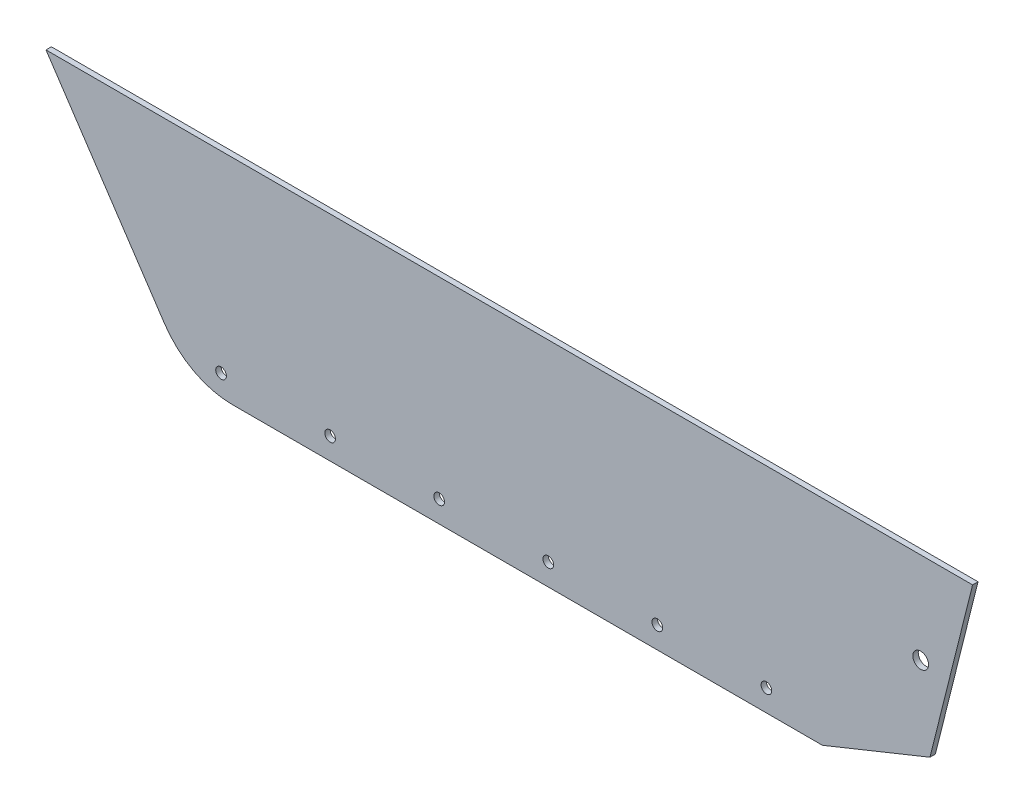
from build123d import *

# Parameters (mm, degrees)
BOSS_EXTRUDE1_DEPTH = 3.175
SKETCH1_4_R         = 3.125
CUT_EXTRUDE1_DEPTH  = 439.905857431
FILLET1_R           = 48
CUT_EXTRUDE3_DEPTH  = 10
CUT_EXTRUDE5_REACH  = 440.906
SKETCH12_R          = 4.625


with BuildPart() as part:
    # Sketch1 → Boss-Extrude1 (new body)
    with BuildSketch(Plane.XY):
        Polygon((-98.879411765, 3.850980392), (-31.879411765, -96.649019608), (366, -96.649019608), (403.120588235, -71.149019608), (428.120588235, 28.939617947), (-115.605170134, 28.939617947), align=None)
    extrude(amount=BOSS_EXTRUDE1_DEPTH)

    # Sketch1<4> → Cut-Extrude1 (cut, through all)
    with BuildSketch(Plane.XY):
        with Locations((-12.879411765, -83.899019608)):
            Circle(SKETCH1_4_R)
        with Locations((51.120588235, -83.899019608)):
            Circle(SKETCH1_4_R)
        with Locations((115.120588235, -83.899019608)):
            Circle(SKETCH1_4_R)
        with Locations((179.120588235, -83.899019608)):
            Circle(SKETCH1_4_R)
        with Locations((243.120588235, -83.899019608)):
            Circle(SKETCH1_4_R)
        with Locations((307.120588235, -83.899019608)):
            Circle(SKETCH1_4_R)
    extrude(amount=CUT_EXTRUDE1_DEPTH, mode=Mode.SUBTRACT)

    # Fillet1
    fillet1_edges = [part.edges().sort_by_distance(p)[0] for p in [
        (-31.879411765, -96.649019608, 1.5875),
    ]]
    fillet(fillet1_edges, radius=FILLET1_R)

    # Sketch7 → Cut-Extrude3 (cut)
    with BuildSketch(Plane.XY.offset(3.175)):
        Polygon((403.120588235, -71.149019608), (340.005873473, -96.649019608), (366, -96.649019608), align=None)
    extrude(amount=-CUT_EXTRUDE3_DEPTH, mode=Mode.SUBTRACT)

    # Sketch12 → Cut-Extrude5 (cut, up to next)
    with BuildSketch(Plane.XY.offset(3.175), mode=Mode.PRIVATE) as cut_extrude5_sk1:
        with Locations((397.677759779, -24.610405856)):
            Circle(SKETCH12_R)
    cut_extrude5_tool1 = extrude(cut_extrude5_sk1.sketch, amount=-CUT_EXTRUDE5_REACH, mode=Mode.PRIVATE) & part.part
    add(cut_extrude5_tool1.solids().sort_by_distance((397.67776, -24.610406, 3.175))[0], mode=Mode.SUBTRACT)


solid = part.part
